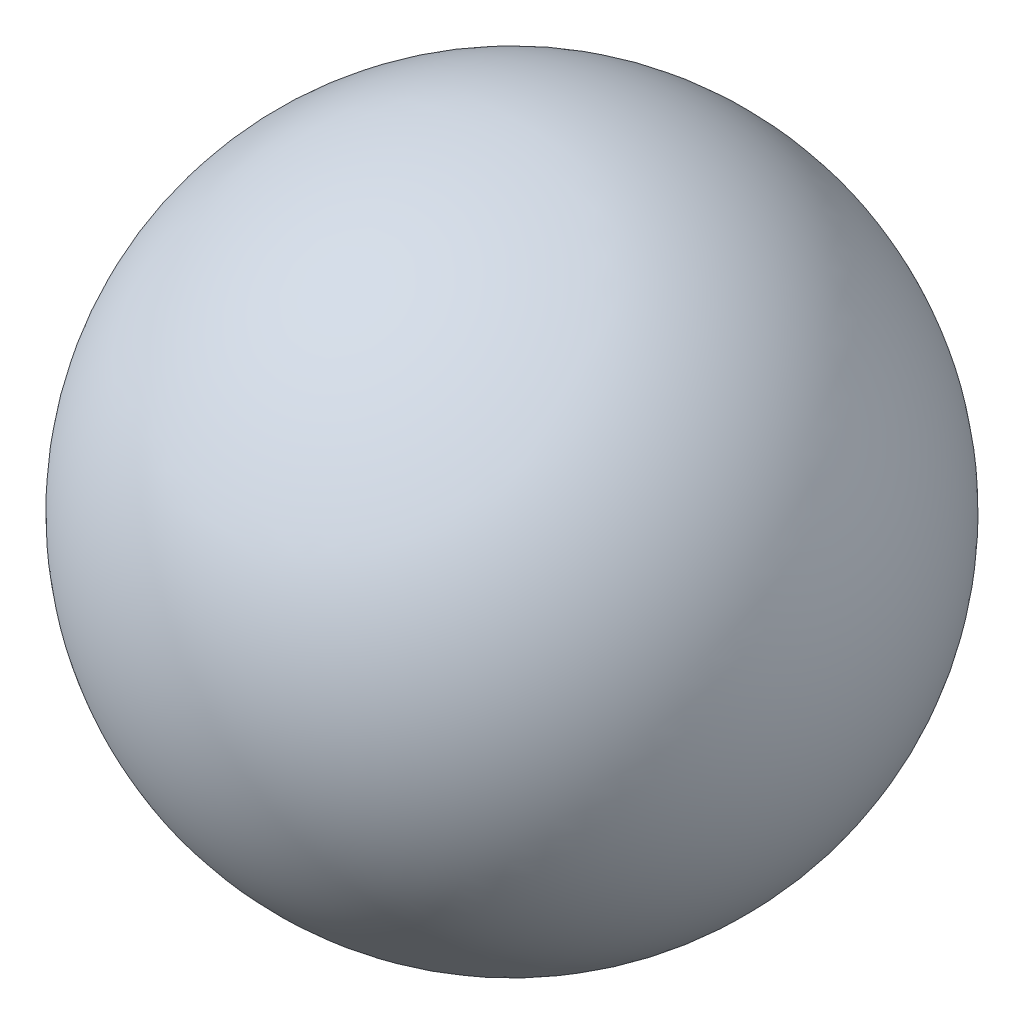
from build123d import *


with BuildPart() as part:
    # Sketch1 → Revolve1 (revolve)
    with BuildSketch(Plane(origin=(0, 0, 0), x_dir=(1, 0, 0), z_dir=(0, 1, 0))):
        with BuildLine():
            Line((0, 9.9), (0, -9.9))
            ThreePointArc((0, -9.9), (-9.9, 0), (0, 9.9))
        make_face()
    revolve(axis=Axis((0, 0, -9.9), (0, 0, 1)))


solid = part.part
